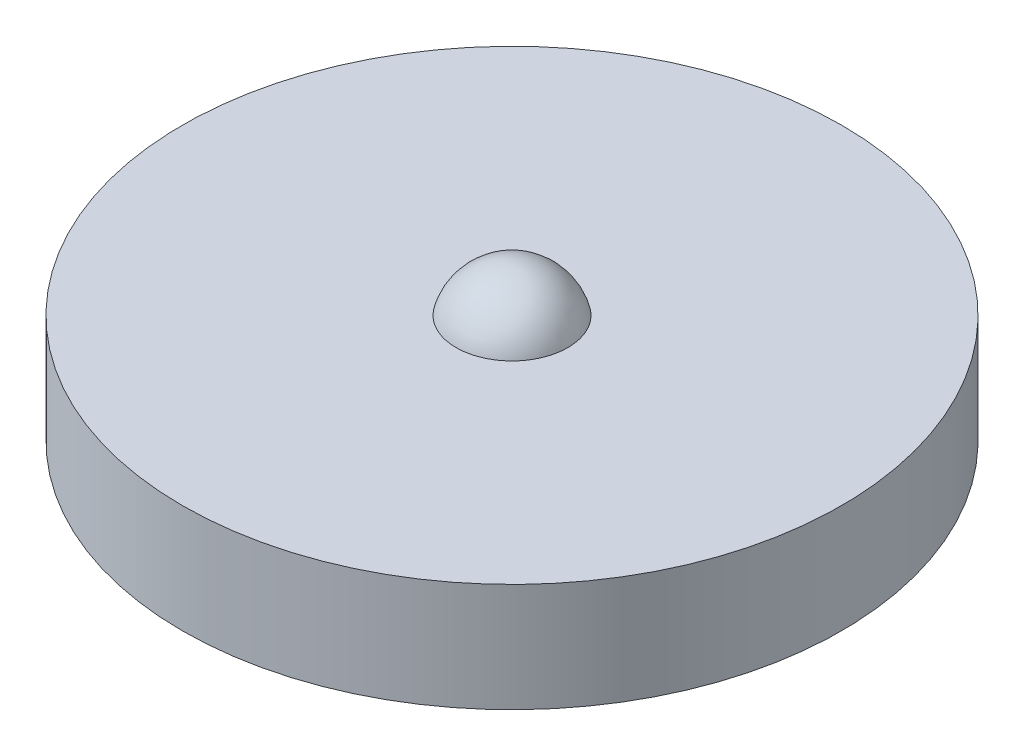
from build123d import *
from build123d.topology import SkipClean

# Parameters (mm, degrees)
BOSS_EXTRUDE5_DEPTH       = 0.127
BOSS_EXTRUDE5_DEPTH_BACK  = 38.227
SKETCH8_R                 = 25.4
CIRPATTERN1_COUNT         = 4
REVOLVE3_ANGLE            = 180
BOSS_EXTRUDE11_DEPTH      = 3.175
BOSS_EXTRUDE11_DEPTH_BACK = 44.45
SKETCH12_R                = 144.672083301


with BuildPart() as part:
    # Sweep1: sweep along a path in Sketch2
    with BuildLine(Plane(origin=(0, 0, -63.5), x_dir=(-1, 0, 0), z_dir=(0, 0, -1))) as sweep1_path:
        Line((0, 0), (-21.997045256, 38.1))
    # Sketch6 → Sweep1 (sweep)
    with BuildSketch(Plane(origin=(0, 0, 0), x_dir=(1, 0, 0), z_dir=(0, 1, 0))):
        with BuildLine():
            Line((0, -12.7), (0, -11.43))
            ThreePointArc((0, -11.43), (-56.932943249, 112.214934805), (74.028683267, 75.087016601))
            Line((74.028683267, 75.087016601), (75.283406713, 75.283406713))
            ThreePointArc((75.283406713, 75.283406713), (-57.897908388, 113.040611666), (0, -12.7))
        make_face()
    sweep(path=sweep1_path.line)

    # Sketch8 → Boss-Extrude5 (add, two sides: drawn at the far end of the back side and taken through both)
    with SkipClean():  # the faces are left unmerged after this step: merging them gives an invalid solid
        with BuildSketch(Plane(origin=(0, 38.227, 0), x_dir=(1, 0, 0), z_dir=(0, 1, 0)).offset(-BOSS_EXTRUDE5_DEPTH_BACK)):
            with Locations(Location((0, 0, 0), (0, 0, 168.522507292))):
                Circle(SKETCH8_R)
        extrude(amount=BOSS_EXTRUDE5_DEPTH + BOSS_EXTRUDE5_DEPTH_BACK)


with BuildPart() as cirpattern1_1:
    # CirPattern1: pattern copy
    add(part.part.rotate(Axis((0, 38.354, 0), (0, -1, 0)), 1 * 360 / CIRPATTERN1_COUNT))


with BuildPart() as cirpattern1_2:
    # CirPattern1: pattern copy
    add(part.part.rotate(Axis((0, 38.354, 0), (0, -1, 0)), 2 * 360 / CIRPATTERN1_COUNT))


with BuildPart() as cirpattern1_3:
    # CirPattern1: pattern copy
    add(part.part.rotate(Axis((0, 38.354, 0), (0, -1, 0)), 3 * 360 / CIRPATTERN1_COUNT))


with BuildPart() as body_5:
    # Sketch8<5> → Revolve3 (revolve)
    with BuildSketch(Plane(origin=(0, 38.227, 0), x_dir=(1, 0, 0), z_dir=(0, 1, 0))):
        with BuildLine():
            ThreePointArc((25.4, 0), (0, 25.4), (-25.4, 0))
            Line((-25.4, 0), (25.4, 0))
        make_face()
    revolve(axis=Axis((-25.4, 38.227, 0), (1, 0, 0)), revolution_arc=REVOLVE3_ANGLE)


with BuildPart() as body_6:
    # Sketch12 → Boss-Extrude11 (new, two sides: drawn at the far end of the back side and taken through both)
    with BuildSketch(Plane.XZ.offset(-BOSS_EXTRUDE11_DEPTH_BACK)):
        with Locations(Location((0, 0, 0), (0, 0, 270))):
            Circle(SKETCH12_R)
    extrude(amount=BOSS_EXTRUDE11_DEPTH + BOSS_EXTRUDE11_DEPTH_BACK)


solid = Compound([part.part, cirpattern1_1.part, cirpattern1_2.part, cirpattern1_3.part, body_5.part, body_6.part])
